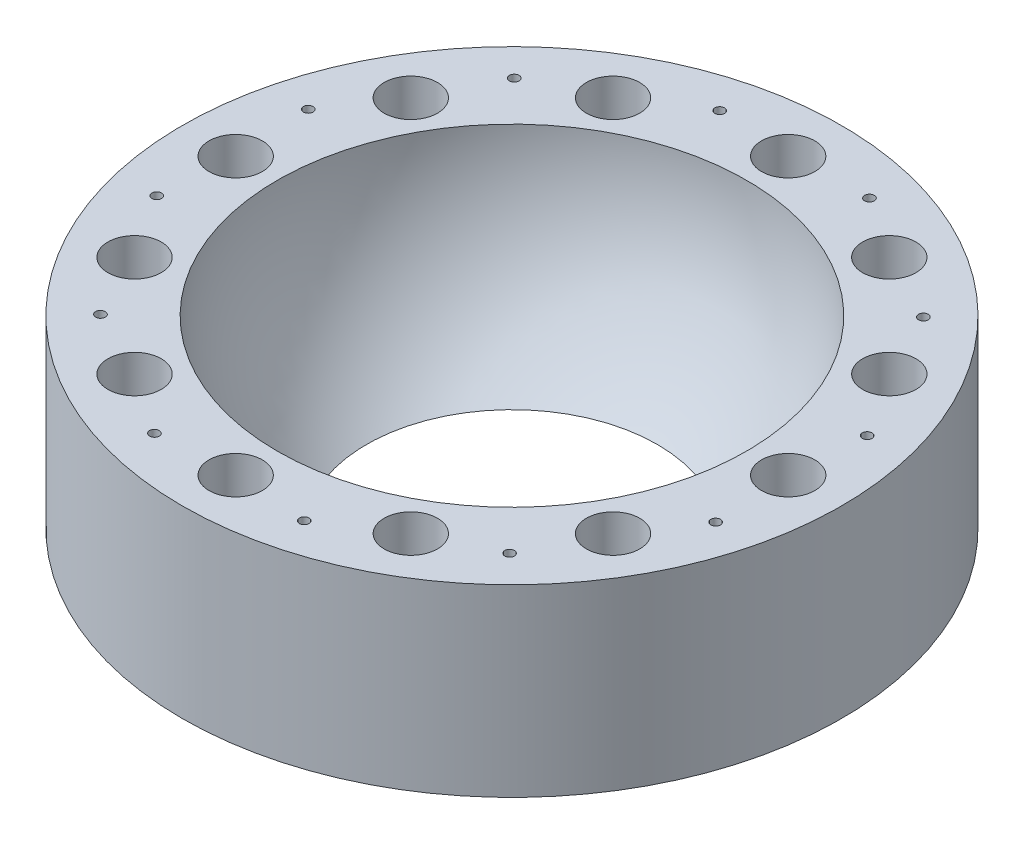
from build123d import *

# Parameters (mm, degrees)
SKETCH_1_R          = 68
SKETCH_1_R_2        = 5.5
EXTRUDE_1_DEPTH     = 60
SKETCH_2_R          = 8.75
CUT_EXTRUDE_1_DEPTH = 10.8
SKETCH_4_R          = 8.75
CUT_EXTRUDE_2_DEPTH = 10.8
CUT_EXTRUDE_START   = -22
SKETCH_6_R          = 68
CUT_EXTRUDE_6_DEPTH = 22
SKETCH_9_R          = 1
CUT_EXTRUDE_7_DEPTH = 104.402127638


with BuildPart() as part:
    # 草图1 → 凸台-拉伸1 (new body)
    with BuildSketch(Plane(origin=(0, 0, 0), x_dir=(1, 0, 0), z_dir=(0, 1, 0))):
        with Locations(Location((0, 0, 0), (0, 0, 270))):
            Circle(SKETCH_1_R)
        with Locations(Location((0, 57, 0), (0, 0, 270))):
            Circle(SKETCH_1_R_2, mode=Mode.SUBTRACT)
        with Locations(Location((28.5, 49.363448016, 0), (0, 0, 270))):
            Circle(SKETCH_1_R_2, mode=Mode.SUBTRACT)
        with Locations(Location((49.363448016, 28.5, 0), (0, 0, 270))):
            Circle(SKETCH_1_R_2, mode=Mode.SUBTRACT)
        with Locations(Location((57, 0, 0), (0, 0, 270))):
            Circle(SKETCH_1_R_2, mode=Mode.SUBTRACT)
        with Locations(Location((49.363448016, -28.5, 0), (0, 0, 270))):
            Circle(SKETCH_1_R_2, mode=Mode.SUBTRACT)
        with Locations(Location((28.5, -49.363448016, 0), (0, 0, 270))):
            Circle(SKETCH_1_R_2, mode=Mode.SUBTRACT)
        with Locations(Location((0, -57, 0), (0, 0, 270))):
            Circle(SKETCH_1_R_2, mode=Mode.SUBTRACT)
        with Locations(Location((-28.5, -49.363448016, 0), (0, 0, 270))):
            Circle(SKETCH_1_R_2, mode=Mode.SUBTRACT)
        with Locations(Location((-49.363448016, -28.5, 0), (0, 0, 270))):
            Circle(SKETCH_1_R_2, mode=Mode.SUBTRACT)
        with Locations(Location((-57, 0, 0), (0, 0, 270))):
            Circle(SKETCH_1_R_2, mode=Mode.SUBTRACT)
        with Locations(Location((-49.363448016, 28.5, 0), (0, 0, 270))):
            Circle(SKETCH_1_R_2, mode=Mode.SUBTRACT)
        with Locations(Location((-28.5, 49.363448016, 0), (0, 0, 270))):
            Circle(SKETCH_1_R_2, mode=Mode.SUBTRACT)
    extrude(amount=EXTRUDE_1_DEPTH)

    # 草图2 → 切除-拉伸1 (cut)
    with BuildSketch(Plane(origin=(0, 60, 0), x_dir=(1, 0, 0), z_dir=(0, 1, 0))):
        with Locations(Location((0, 57, 0), (0, 0, 270))):
            Circle(SKETCH_2_R)
        with Locations(Location((49.363448016, 28.5, 0), (0, 0, 270))):
            Circle(SKETCH_2_R)
        with Locations(Location((49.363448016, -28.5, 0), (0, 0, 270))):
            Circle(SKETCH_2_R)
        with Locations(Location((0, -57, 0), (0, 0, 270))):
            Circle(SKETCH_2_R)
        with Locations(Location((-49.363448016, -28.5, 0), (0, 0, 270))):
            Circle(SKETCH_2_R)
        with Locations(Location((-49.363448016, 28.5, 0), (0, 0, 270))):
            Circle(SKETCH_2_R)
    extrude(amount=-CUT_EXTRUDE_1_DEPTH, mode=Mode.SUBTRACT)

    # 草图4 → 切除-拉伸2 (cut)
    with BuildSketch(Plane.XZ):
        with Locations(Location((28.5, 49.363448016, 0), (0, 0, 270))):
            Circle(SKETCH_4_R)
        with Locations(Location((57, 0, 0), (0, 0, 270))):
            Circle(SKETCH_4_R)
        with Locations(Location((28.5, -49.363448016, 0), (0, 0, 270))):
            Circle(SKETCH_4_R)
        with Locations(Location((-28.5, -49.363448016, 0), (0, 0, 270))):
            Circle(SKETCH_4_R)
        with Locations(Location((-57, 0, 0), (0, 0, 270))):
            Circle(SKETCH_4_R)
        with Locations(Location((-28.5, 49.363448016, 0), (0, 0, 270))):
            Circle(SKETCH_4_R)
    extrude(amount=-CUT_EXTRUDE_2_DEPTH, mode=Mode.SUBTRACT)

    # 草图6 → 切除-拉伸6 (cut)
    with BuildSketch(Plane(origin=(0, 60, 0), x_dir=(1, 0, 0), z_dir=(0, 1, 0)).offset(CUT_EXTRUDE_START)):
        with Locations(Location((0, 0, 0), (0, 0, 270))):
            Circle(SKETCH_6_R)
    extrude(amount=CUT_EXTRUDE_6_DEPTH, mode=Mode.SUBTRACT)

    # 草图8 → 切除-旋转3 (revolve, cut)
    with BuildSketch(Plane.XY):
        with BuildLine():
            Line((0, 38), (0, 0))
            Line((0, 0), (0, -10.414873748))
            ThreePointArc((0, -10.414873748), (48.414873748, 38), (0, 86.414873748))
            Line((0, 86.414873748), (0, 38))
        make_face()
    revolve(axis=Axis((0, -10.414873748, 0), (0, 1, 0)), mode=Mode.SUBTRACT)

    # 草图9 → 切除-拉伸7 (cut, through all)
    with BuildSketch(Plane.XZ):
        with Locations(Location((15.210350017, 58.075311231, 0), (0, 0, 270))):
            Circle(SKETCH_9_R)
        with Locations(Location((42.210205131, 42.689519851, 0), (0, 0, 270))):
            Circle(SKETCH_9_R)
        with Locations(Location((57.899869867, 15.865106101, 0), (0, 0, 270))):
            Circle(SKETCH_9_R)
        with Locations(Location((58.075311231, -15.210350017, 0), (0, 0, 270))):
            Circle(SKETCH_9_R)
        with Locations(Location((42.689519851, -42.210205131, 0), (0, 0, 270))):
            Circle(SKETCH_9_R)
        with Locations(Location((15.865106101, -57.899869867, 0), (0, 0, 270))):
            Circle(SKETCH_9_R)
        with Locations(Location((-15.210350017, -58.075311231, 0), (0, 0, 270))):
            Circle(SKETCH_9_R)
        with Locations(Location((-42.210205131, -42.689519851, 0), (0, 0, 270))):
            Circle(SKETCH_9_R)
        with Locations(Location((-57.899869867, -15.865106101, 0), (0, 0, 270))):
            Circle(SKETCH_9_R)
        with Locations(Location((-58.075311231, 15.210350017, 0), (0, 0, 270))):
            Circle(SKETCH_9_R)
        with Locations(Location((-42.689519851, 42.210205131, 0), (0, 0, 270))):
            Circle(SKETCH_9_R)
        with Locations(Location((-15.865106101, 57.899869867, 0), (0, 0, 270))):
            Circle(SKETCH_9_R)
    extrude(amount=-CUT_EXTRUDE_7_DEPTH, mode=Mode.SUBTRACT)


solid = part.part
